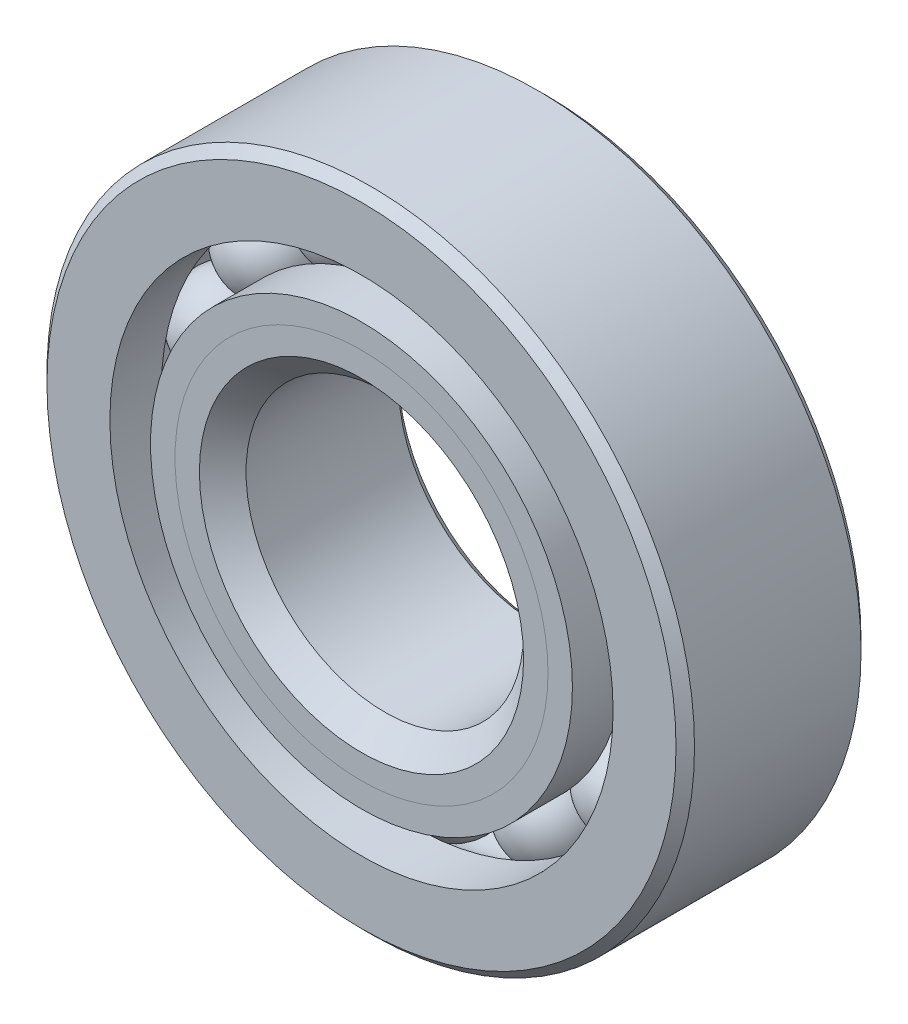
from build123d import *

# Parameters (mm, degrees)
CIRPATTERN1_COUNT = 14


with BuildPart() as part:
    # Sketch1 → Revolve1 (revolve)
    with BuildSketch(Plane(origin=(0, 0, 0), x_dir=(0, 0, -1), z_dir=(1, 0, 0))):
        with BuildLine():
            Line((2.8575, 11.1125), (-2.8575, 11.1125))
            Line((-2.8575, 11.1125), (-3.175, 10.795))
            Line((-3.175, 10.795), (-3.175, 8.635302198))
            Line((-3.175, 8.635302198), (-1.411111111, 8.635302198))
            ThreePointArc((-1.411111111, 8.635302198), (0, 9.511718052), (1.411111111, 8.635302198))
            Line((1.411111111, 8.635302198), (3.175, 8.635302198))
            Line((3.175, 8.635302198), (3.175, 10.795))
            Line((3.175, 10.795), (2.8575, 11.1125))
        make_face()
    revolve(axis=Axis((0, 0, 3.175), (0, 0, -1)))


with BuildPart() as body_2:
    # Sketch2 → Revolve2 (revolve)
    with BuildSketch(Plane(origin=(0, 0, 0), x_dir=(0, 0, -1), z_dir=(1, 0, 0))):
        with BuildLine():
            Line((-3.175, 7.239697802), (-1.411111111, 7.239697802))
            ThreePointArc((-1.411111111, 7.239697802), (-0.830562959, 6.600216318), (0, 6.363281948))
            Line((0, 6.363281948), (0, 5.562890974))
            Line((0, 5.562890974), (-2.336596586, 5.562890974))
            Line((-2.336596586, 5.562890974), (-3.175, 6.401294388))
            Line((-3.175, 6.401294388), (-3.175, 7.239697802))
        make_face()
    revolve(axis=Axis((0, 0, 3.175), (0, 0, -1)))


with BuildPart() as body_3:
    # Sketch3 → Revolve3 (revolve)
    with BuildSketch(Plane(origin=(0, 0, 0), x_dir=(0, 0, -1), z_dir=(1, 0, 0))):
        with BuildLine():
            Line((-3.175, 6.401294388), (-2.336596586, 5.562890974))
            Line((-2.336596586, 5.562890974), (0, 5.562890974))
            Line((0, 5.562890974), (0, 6.363281948))
            ThreePointArc((0, 6.363281948), (0.830562959, 6.600216318), (1.411111111, 7.239697802))
            Line((1.411111111, 7.239697802), (3.175, 7.239697802))
            Line((3.175, 7.239697802), (3.175, 5.08))
            Line((3.175, 5.08), (2.8575, 4.7625))
            Line((2.8575, 4.7625), (-2.374609026, 4.7625))
            Line((-2.374609026, 4.7625), (-3.175, 5.562890974))
            Line((-3.175, 5.562890974), (-3.175, 6.401294388))
        make_face()
    revolve(axis=Axis((0, 0, 3.175), (0, 0, -1)))


with BuildPart() as body_4:
    # Sketch4 → Revolve4 (revolve)
    with BuildSketch(Plane(origin=(0, 0, 0), x_dir=(0, 0, -1), z_dir=(1, 0, 0))):
        with BuildLine():
            Line((-1.574218052, 7.9375), (1.574218052, 7.9375))
            ThreePointArc((1.574218052, 7.9375), (0, 9.511718052), (-1.574218052, 7.9375))
        make_face()
    revolve(axis=Axis((0, 7.9375, 1.574218052), (0, 0, -1)))


with BuildPart() as cirpattern1_1:
    # CirPattern1: pattern copy
    add(body_4.part.rotate(Axis((0, 0, -3.175), (0, 0, 1)), 1 * 360 / CIRPATTERN1_COUNT))


with BuildPart() as cirpattern1_2:
    # CirPattern1: pattern copy
    add(body_4.part.rotate(Axis((0, 0, -3.175), (0, 0, 1)), 2 * 360 / CIRPATTERN1_COUNT))


with BuildPart() as cirpattern1_3:
    # CirPattern1: pattern copy
    add(body_4.part.rotate(Axis((0, 0, -3.175), (0, 0, 1)), 3 * 360 / CIRPATTERN1_COUNT))


with BuildPart() as cirpattern1_4:
    # CirPattern1: pattern copy
    add(body_4.part.rotate(Axis((0, 0, -3.175), (0, 0, 1)), 4 * 360 / CIRPATTERN1_COUNT))


with BuildPart() as cirpattern1_5:
    # CirPattern1: pattern copy
    add(body_4.part.rotate(Axis((0, 0, -3.175), (0, 0, 1)), 5 * 360 / CIRPATTERN1_COUNT))


with BuildPart() as cirpattern1_6:
    # CirPattern1: pattern copy
    add(body_4.part.rotate(Axis((0, 0, -3.175), (0, 0, 1)), 6 * 360 / CIRPATTERN1_COUNT))


with BuildPart() as cirpattern1_7:
    # CirPattern1: pattern copy
    add(body_4.part.rotate(Axis((0, 0, -3.175), (0, 0, 1)), 7 * 360 / CIRPATTERN1_COUNT))


with BuildPart() as cirpattern1_8:
    # CirPattern1: pattern copy
    add(body_4.part.rotate(Axis((0, 0, -3.175), (0, 0, 1)), 8 * 360 / CIRPATTERN1_COUNT))


with BuildPart() as cirpattern1_9:
    # CirPattern1: pattern copy
    add(body_4.part.rotate(Axis((0, 0, -3.175), (0, 0, 1)), 9 * 360 / CIRPATTERN1_COUNT))


with BuildPart() as cirpattern1_10:
    # CirPattern1: pattern copy
    add(body_4.part.rotate(Axis((0, 0, -3.175), (0, 0, 1)), 10 * 360 / CIRPATTERN1_COUNT))


with BuildPart() as cirpattern1_11:
    # CirPattern1: pattern copy
    add(body_4.part.rotate(Axis((0, 0, -3.175), (0, 0, 1)), 11 * 360 / CIRPATTERN1_COUNT))


with BuildPart() as cirpattern1_12:
    # CirPattern1: pattern copy
    add(body_4.part.rotate(Axis((0, 0, -3.175), (0, 0, 1)), 12 * 360 / CIRPATTERN1_COUNT))


with BuildPart() as cirpattern1_13:
    # CirPattern1: pattern copy
    add(body_4.part.rotate(Axis((0, 0, -3.175), (0, 0, 1)), 13 * 360 / CIRPATTERN1_COUNT))


solid = Compound([part.part, body_2.part, body_3.part, body_4.part, cirpattern1_1.part, cirpattern1_2.part, cirpattern1_3.part, cirpattern1_4.part, cirpattern1_5.part, cirpattern1_6.part, cirpattern1_7.part, cirpattern1_8.part, cirpattern1_9.part, cirpattern1_10.part, cirpattern1_11.part, cirpattern1_12.part, cirpattern1_13.part])
